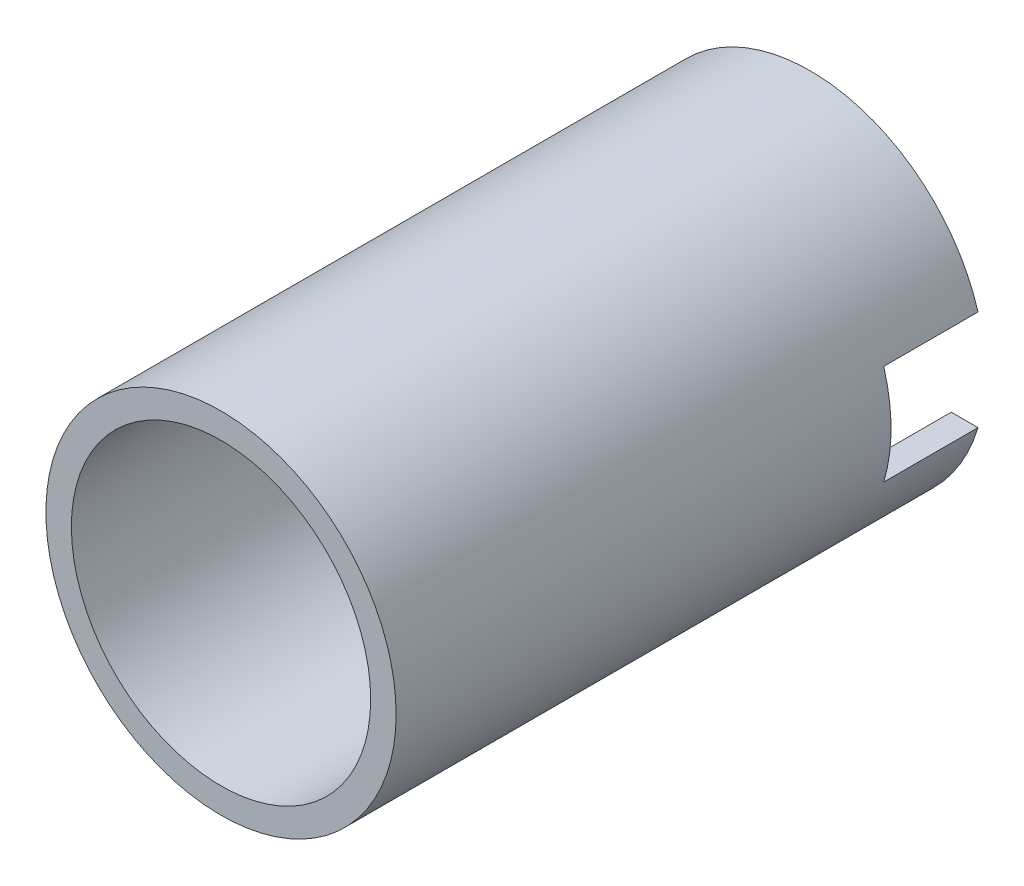
from build123d import *

# Parameters (mm, degrees)
CROQUIS1_R              = 29.72
CROQUIS1_R_2            = 25.4
SALIENTE_EXTRUIR1_DEPTH = 100
CORTAR_EXTRUIR2_DEPTH   = 109.473760883
CROQUIS4_W              = 16
CROQUIS4_H              = 17
CORTAR_EXTRUIR3_DEPTH   = 109.47376103


with BuildPart() as part:
    # Croquis1 → Saliente-Extruir1 (new body)
    with BuildSketch(Plane.XY):
        Circle(CROQUIS1_R)
        Circle(CROQUIS1_R_2, mode=Mode.SUBTRACT)
    extrude(amount=SALIENTE_EXTRUIR1_DEPTH)

    # Croquis3 → Cortar-Extruir2 (cut, through all)
    with BuildSketch(Plane(origin=(0, 0, 0), x_dir=(0, 0, -1), z_dir=(1, 0, 0))):
        with BuildLine():
            Line((0, 21), (-21, 21))
            ThreePointArc((-21, 21), (-42, 0), (-21, -21))
            Line((-21, -21), (0, -21))
            Line((0, -21), (0, 21))
        make_face()
    extrude(amount=-CORTAR_EXTRUIR2_DEPTH, mode=Mode.SUBTRACT)

    # Croquis4 → Cortar-Extruir3 (cut, through all)
    with BuildSketch(Plane(origin=(0, 0, 0), x_dir=(0, 0, -1), z_dir=(1, 0, 0))):
        with Locations((-8, 0)):
            Rectangle(CROQUIS4_W, CROQUIS4_H)
    extrude(amount=CORTAR_EXTRUIR3_DEPTH, mode=Mode.SUBTRACT)


solid = part.part
